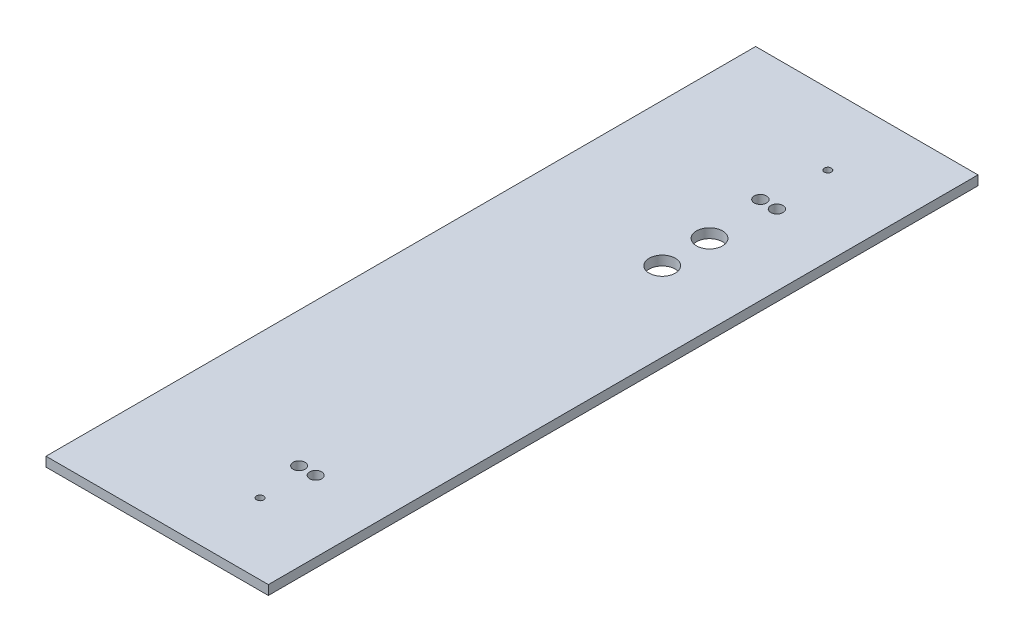
from build123d import *

# Parameters (mm, degrees)
SKETCH1_W           = 188
SKETCH1_H           = 600
BOSS_EXTRUDE1_DEPTH = 8
SKETCH2_R           = 5.1
SKETCH2_R_2         = 3
SKETCH2_R_3         = 11
SKETCH2_R_4         = 5.2
CUT_EXTRUDE1_DEPTH  = 629.814758097


with BuildPart() as part:
    # Sketch1 → Boss-Extrude1 (new body)
    with BuildSketch(Plane(origin=(0, 0, 0), x_dir=(1, 0, 0), z_dir=(0, 1, 0))):
        with Locations((94, 300)):
            Rectangle(SKETCH1_W, SKETCH1_H)
    extrude(amount=BOSS_EXTRUDE1_DEPTH)

    # Sketch2 → Cut-Extrude1 (cut, through all)
    with BuildSketch(Plane(origin=(0, 8, 0), x_dir=(1, 0, 0), z_dir=(0, 1, 0))):
        with Locations(Location((114, 100, 0), (0, 0, 270))):
            Circle(SKETCH2_R)
        with Locations(Location((128, 100, 0), (0, 0, 270))):
            Circle(SKETCH2_R)
        with Locations(Location((121, 60, 0), (0, 0, 270))):
            Circle(SKETCH2_R_2)
        with Locations(Location((121, 440, 0), (0, 0, 270))):
            Circle(SKETCH2_R_3)
        with Locations(Location((121, 400, 0), (0, 0, 270))):
            Circle(SKETCH2_R_3)
        with Locations(Location((114, 490, 0), (0, 0, 270))):
            Circle(SKETCH2_R_4)
        with Locations(Location((128, 490, 0), (0, 0, 270))):
            Circle(SKETCH2_R_4)
        with Locations(Location((121, 540, 0), (0, 0, 270))):
            Circle(SKETCH2_R_2)
    extrude(amount=-CUT_EXTRUDE1_DEPTH, mode=Mode.SUBTRACT)


solid = part.part
